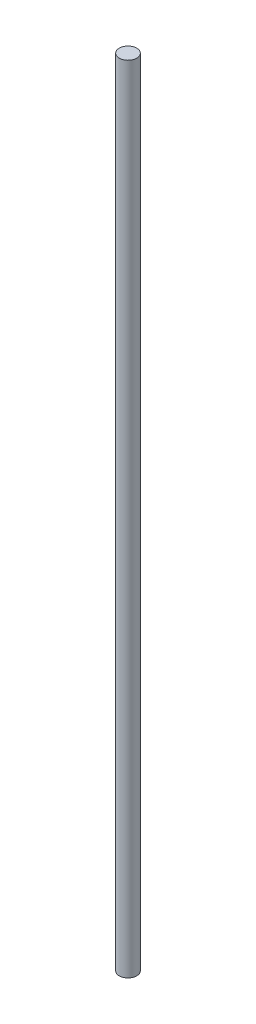
from build123d import *

# Parameters (mm, degrees)
SKETCH1_R           = 3.175
BOSS_EXTRUDE1_DEPTH = 288.925


with BuildPart() as part:
    # Sketch1 → Boss-Extrude1 (new body)
    with BuildSketch(Plane(origin=(0, 0, 0), x_dir=(1, 0, 0), z_dir=(0, 1, 0))):
        with Locations(Location((0, 0, 0), (0, 0, 270))):
            Circle(SKETCH1_R)
    extrude(amount=BOSS_EXTRUDE1_DEPTH)


solid = part.part
